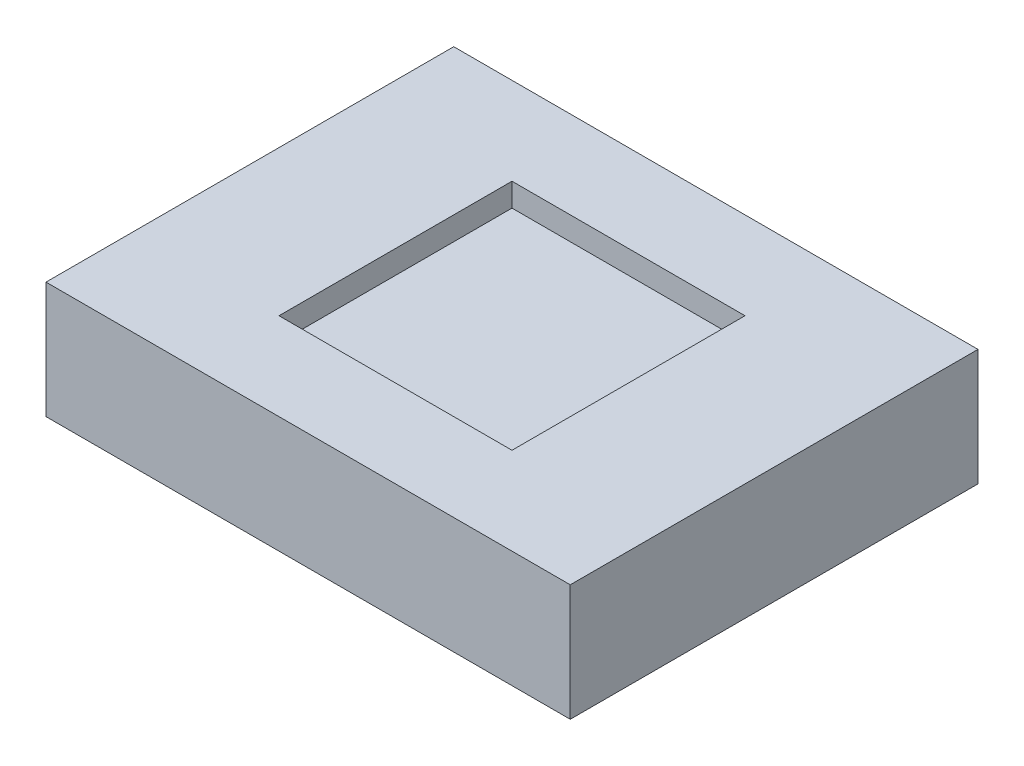
from build123d import *

# Parameters (mm, degrees)
SKETCH2_W           = 45
SKETCH2_H           = 35
BOSS_EXTRUDE1_DEPTH = 10
SKETCH3_W           = 20
SKETCH3_H           = 20
CUT_EXTRUDE1_DEPTH  = 2
SKETCH10_R          = 2.85
CUT_EXTRUDE2_DEPTH  = 7


with BuildPart() as part:
    # Sketch2 → Boss-Extrude1 (new body)
    with BuildSketch(Plane(origin=(0, 0, 0), x_dir=(1, 0, 0), z_dir=(0, 1, 0))):
        Rectangle(SKETCH2_W, SKETCH2_H)
    extrude(amount=BOSS_EXTRUDE1_DEPTH)

    # Sketch3 → Cut-Extrude1 (cut)
    with BuildSketch(Plane(origin=(0, 10, 0), x_dir=(1, 0, 0), z_dir=(0, 1, 0))):
        Rectangle(SKETCH3_W, SKETCH3_H)
    extrude(amount=-CUT_EXTRUDE1_DEPTH, mode=Mode.SUBTRACT)

    # Sketch10 → Cut-Extrude2 (cut)
    with BuildSketch(Plane.XZ):
        with Locations(Location((-18.75, 13.75, 0), (0, 0, 270))):
            Circle(SKETCH10_R)
        with Locations(Location((18.754391979, 13.75, 0), (0, 0, 270))):
            Circle(SKETCH10_R)
        with Locations(Location((18.754391979, -13.75, 0), (0, 0, 270))):
            Circle(SKETCH10_R)
        with Locations(Location((-18.75, -13.75, 0), (0, 0, 270))):
            Circle(SKETCH10_R)
    extrude(amount=-CUT_EXTRUDE2_DEPTH, mode=Mode.SUBTRACT)


solid = part.part
